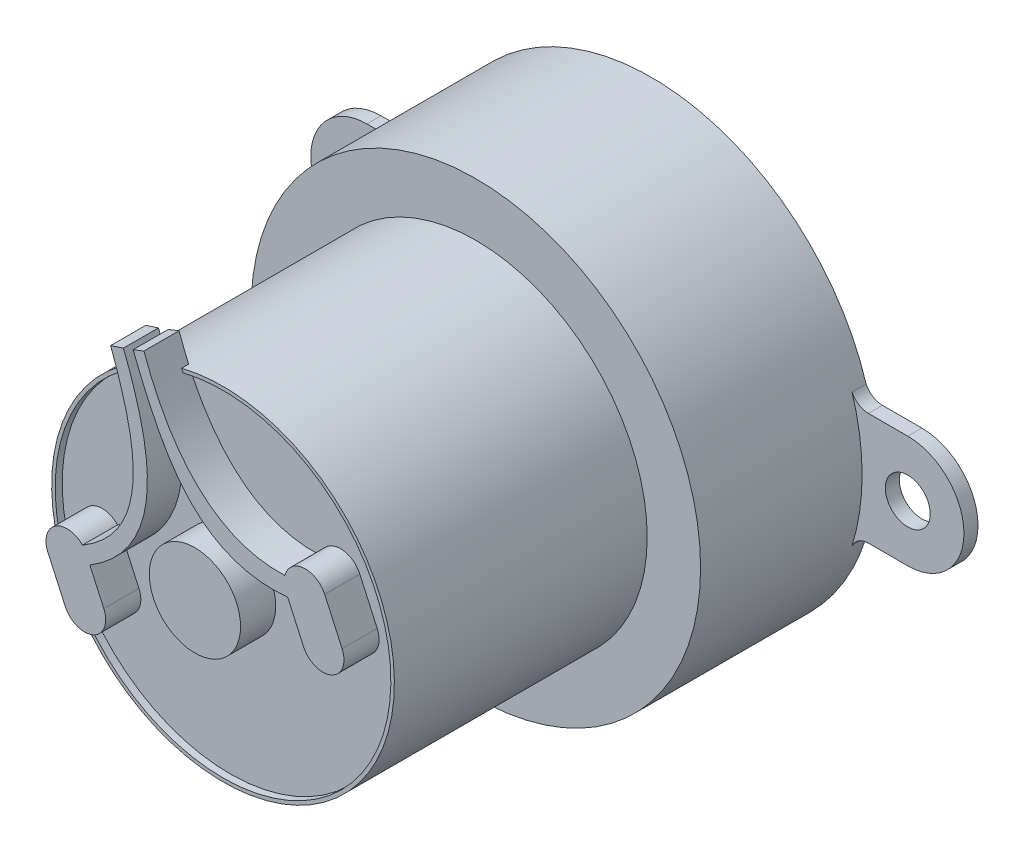
from build123d import *
from build123d.topology import SkipClean

# Parameters (mm, degrees)
CROQUIS1_R               = 1.6
SALIENTE_EXTRUIR1_DEPTH  = 1
CROQUIS2_R               = 16
SALIENTE_EXTRUIR2_DEPTH  = 11.5
CROQUIS3_R               = 12.2
SALIENTE_EXTRUIR3_DEPTH  = 18
CROQUIS4_R               = 11.95
CORTAR_EXTRUIR1_DEPTH    = 0.5
CROQUIS5_R               = 3.25
SALIENTE_EXTRUIR4_DEPTH  = 2.5
SALIENTE_EXTRUIR6_DEPTH  = 2.5
SALIENTE_EXTRUIR7_START  = 2.5
SALIENTE_EXTRUIR7_DEPTH  = 2.5
CROQUIS8_W               = 0.240154474
CROQUIS8_H               = 2.311486816
CORTAR_EXTRUIR2_DEPTH    = 0.5
CROQUIS9_R               = 4.85
SALIENTE_EXTRUIR8_DEPTH  = 2
CROQUIS11_R              = 4
SALIENTE_EXTRUIR9_DEPTH  = 0.2
CROQUIS12_R              = 2.5
SALIENTE_EXTRUIR10_DEPTH = 1.2
SALIENTE_EXTRUIR11_DEPTH = 6.7
CROQUIS14_R              = 1.6
SALIENTE_EXTRUIR12_DEPTH = 0.2
CORTAR_EXTRUIR3_DEPTH    = 0.2
CORTAR_EXTRUIR4_DEPTH    = 0.2


with BuildPart() as part:
    # Croquis1 → Saliente-Extruir1 (new body)
    with BuildSketch(Plane.XY):
        with BuildLine():
            ThreePointArc((-16.45, -4), (-15.762313684, -4.197739458), (-15.284693364, -4.730554804))
            ThreePointArc((-15.284693364, -4.730554804), (0, -16), (15.284693364, -4.730554804))
            ThreePointArc((15.284693364, -4.730554804), (15.762313684, -4.197739458), (16.45, -4))
            Line((16.45, -4), (19.25, -4))
            ThreePointArc((19.25, -4), (23.25, 0), (19.25, 4))
            Line((19.25, 4), (16.45, 4))
            ThreePointArc((16.45, 4), (15.762313684, 4.197739458), (15.284693364, 4.730554804))
            ThreePointArc((15.284693364, 4.730554804), (0, 16), (-15.284693364, 4.730554804))
            ThreePointArc((-15.284693364, 4.730554804), (-15.762313684, 4.197739458), (-16.45, 4))
            Line((-16.45, 4), (-19.25, 4))
            ThreePointArc((-19.25, 4), (-23.25, 0), (-19.25, -4))
            Line((-19.25, -4), (-16.45, -4))
        make_face()
        with Locations((-19.25, 0)):
            Circle(CROQUIS1_R, mode=Mode.SUBTRACT)
        with Locations((19.25, 0)):
            Circle(CROQUIS1_R, mode=Mode.SUBTRACT)
    extrude(amount=SALIENTE_EXTRUIR1_DEPTH)

    # Croquis2 → Saliente-Extruir2 (add)
    with BuildSketch(Plane.XY.offset(1)):
        with Locations(Location((0, 0, 0), (0, 0, 162.802901405))):
            Circle(CROQUIS2_R)
    extrude(amount=SALIENTE_EXTRUIR2_DEPTH)

    # Croquis3 → Saliente-Extruir3 (add)
    with BuildSketch(Plane.XY.offset(12.5)):
        Circle(CROQUIS3_R)
    extrude(amount=SALIENTE_EXTRUIR3_DEPTH)

    # Croquis4 → Cortar-Extruir1 (cut)
    with BuildSketch(Plane.XY.offset(30.5)):
        Circle(CROQUIS4_R)
    extrude(amount=-CORTAR_EXTRUIR1_DEPTH, mode=Mode.SUBTRACT)

    # Croquis5 → Saliente-Extruir4 (add)
    with BuildSketch(Plane.XY.offset(30)):
        Circle(CROQUIS5_R)
    extrude(amount=SALIENTE_EXTRUIR4_DEPTH)

    # Croquis6 → Saliente-Extruir6 (add)
    with BuildSketch(Plane.XY.offset(30)):
        with BuildLine():
            Line((10.476994696, 2.255916961), (9.238424672, 4.988304981))
            ThreePointArc((9.238424672, 4.988304981), (7.243885391, 5.738622321), (6.493568052, 3.744083039))
            Line((6.493568052, 3.744083039), (7.732138076, 1.011695019))
            ThreePointArc((7.732138076, 1.011695019), (9.726677357, 0.261377679), (10.476994696, 2.255916961))
        make_face()
        with BuildLine():
            Line((-6.487241223, -3.751451634), (-7.725811247, -1.019063613))
            ThreePointArc((-7.725811247, -1.019063613), (-9.720350528, -0.268746274), (-10.470667867, -2.263285555))
            Line((-10.470667867, -2.263285555), (-9.232097843, -4.995673576))
            ThreePointArc((-9.232097843, -4.995673576), (-7.237558562, -5.745990915), (-6.487241223, -3.751451634))
        make_face()
    extrude(amount=SALIENTE_EXTRUIR6_DEPTH)

    # Croquis7 → Saliente-Extruir7 (add)
    with BuildSketch(Plane.XY.offset(30).offset(SALIENTE_EXTRUIR7_START)):
        with BuildLine():
            add(Edge.make_bspline(
                [(-7.480961723, -1.559221935), (-2.422994836, 1.516253338), (-2.915195224, 6.613819829), (-4.40299632, 11.109280958)],
                knots=[0.063043533, 0.063043533, 0.063043533, 0.063043533, 0.882131138, 0.882131138, 0.882131138, 0.882131138], degree=3))
            ThreePointArc((-4.40299632, 11.109280958), (-4.86143825, 10.916451719), (-5.31145955, 10.704713796))
            add(Edge.make_bspline(
                [(-8.007667665, -0.601350332), (-3.447156238, 2.075547121), (-4.027792303, 6.63720219), (-5.31145955, 10.704713796)],
                knots=[0.063509127, 0.063509127, 0.063509127, 0.063509127, 0.864910683, 0.864910683, 0.864910683, 0.864910683], degree=3))
            ThreePointArc((-8.007667665, -0.601350332), (-7.849154454, -0.798341308), (-7.725811247, -1.019063613))
            Line((-7.725811247, -1.019063613), (-7.480961723, -1.559221935))
        make_face()
        with BuildLine():
            ThreePointArc((-5.31145955, 10.704713796), (-4.86143825, 10.916451719), (-4.40299632, 11.109280958))
            add(Edge.make_bspline(
                [(-4.40299632, 11.109280958), (-4.617094812, 11.756189643), (-4.851810172, 12.39062995), (-5.093570104, 13.004781954)],
                knots=[0.882131138, 0.882131138, 0.882131138, 0.882131138, 1, 1, 1, 1], degree=3))
            Line((-5.093570104, 13.004781954), (-5.999280384, 12.708133268))
            add(Edge.make_bspline(
                [(-5.31145955, 10.704713796), (-5.527842623, 11.390359289), (-5.764202051, 12.06196389), (-5.999280384, 12.708133268)],
                knots=[0.864910683, 0.864910683, 0.864910683, 0.864910683, 1, 1, 1, 1], degree=3))
        make_face()
        with BuildLine():
            add(Edge.make_bspline(
                [(-3.629573828, 11.385459755), (-3.899827273, 12.01114588), (-4.154881858, 12.637786156), (-4.40299632, 13.250284315)],
                knots=[0.876590147, 0.876590147, 0.876590147, 0.876590147, 1, 1, 1, 1], degree=3))
            ThreePointArc((-3.629573828, 11.385459755), (-3.236631517, 11.503335013), (-2.839874712, 11.607653149))
            add(Edge.make_bspline(
                [(-2.839874712, 11.607653149), (-3.136799167, 12.252899863), (-3.398874236, 12.908724785), (-3.629573828, 13.558248221)],
                knots=[0.856488018, 0.856488018, 0.856488018, 0.856488018, 1, 1, 1, 1], degree=3))
            Line((-3.629573828, 13.558248221), (-4.40299632, 13.250284315))
        make_face()
        with BuildLine():
            ThreePointArc((-2.839874712, 11.607653149), (-3.236631517, 11.503335013), (-3.629573828, 11.385459755))
            add(Edge.make_bspline(
                [(6.603292332, 3.502022194), (0.752871457, 2.913283209), (-1.790330385, 7.127274996), (-3.629573828, 11.385459755)],
                knots=[0.036709041, 0.036709041, 0.036709041, 0.036709041, 0.876590147, 0.876590147, 0.876590147, 0.876590147], degree=3))
            Line((6.603292332, 3.502022194), (6.493568052, 3.744083039))
            ThreePointArc((6.493568052, 3.744083039), (6.365108629, 4.232337596), (6.405138105, 4.735618806))
            add(Edge.make_bspline(
                [(6.405138105, 4.735618806), (1.729420512, 4.534171783), (-1.131825908, 7.895891242), (-2.839874712, 11.607653149)],
                knots=[0.030939747, 0.030939747, 0.030939747, 0.030939747, 0.856488018, 0.856488018, 0.856488018, 0.856488018], degree=3))
        make_face()
    extrude(amount=-SALIENTE_EXTRUIR7_DEPTH)

    # Croquis8 → Cortar-Extruir2 (cut)
    # profile 1 of 11: a face of its own
    with BuildSketch(Plane(origin=(0, 0, 0), x_dir=(-1, 0, 0), z_dir=(0, 0, -1))):
        Polygon((-4.383996124, 12.208362546), (-4.383996124, 14.519849362), (-4.14384165, 14.519849362), (-4.14384165, 13.368327419), (-3.16352358, 14.519849362), (-2.857701867, 14.519849362), (-3.656027873, 13.582214998), (-2.82299204, 12.208362546), (-3.098794444, 12.208362546), (-3.817381661, 13.392718108), (-4.14384165, 13.009502863), (-4.14384165, 12.208362546), align=None)
    # profile 2 of 11: a face of its own
    with BuildSketch(Plane(origin=(0, 0, 0), x_dir=(-1, 0, 0), z_dir=(0, 0, -1))):
        with Locations((-2.432741019, 13.364105954)):
            Rectangle(CROQUIS8_W, CROQUIS8_H)
    # profile 3 of 11: a face of its own
    with BuildSketch(Plane(origin=(0, 0, 0), x_dir=(-1, 0, 0), z_dir=(0, 0, -1))):
        Polygon((-1.862374142, 12.208362546), (-1.862374142, 14.519849362), (-1.606740962, 14.519849362), (-0.631582461, 12.677414253), (-0.631582461, 14.519849362), (-0.391427987, 14.519849362), (-0.391427987, 12.208362546), (-0.648468322, 12.208362546), (-1.622219668, 14.048452396), (-1.622219668, 12.208362546), align=None)
    # profile 4 of 11: a face of its own
    with BuildSketch(Plane(origin=(0, 0, 0), x_dir=(-1, 0, 0), z_dir=(0, 0, -1))):
        with BuildLine():
            Line((0.959440932, 13.108941825), (0.959440932, 13.379115608))
            Line((0.959440932, 13.379115608), (1.769962283, 13.379115608))
            Line((1.769962283, 13.379115608), (1.769962283, 12.532477276))
            add(Edge.make_bspline(
                [(1.769962283, 12.532477276), (1.73913888, 12.504428867), (1.678812556, 12.449533651), (1.582665706, 12.377861404), (1.485322908, 12.31625377), (1.386260563, 12.265918637), (1.285656864, 12.22638462), (1.18357552, 12.198781232), (1.079939459, 12.181655214), (1.01031942, 12.179449778), (0.97538869, 12.178343236)],
                knots=[0, 0, 0, 0, 1.121144615, 2.194259096, 3.22291754, 4.218514423, 5.180530362, 6.126881594, 7.060193117, 8, 8, 8, 8], degree=3))
            add(Edge.make_bspline(
                [(0.97538869, 12.178343236), (0.952395006, 12.17887765), (0.906798365, 12.179937397), (0.83935409, 12.185836343), (0.773737064, 12.196857133), (0.710081813, 12.211744858), (0.648194683, 12.230904456), (0.588617252, 12.255291255), (0.530237816, 12.282545969), (0.474425188, 12.315185928), (0.420971707, 12.351710518), (0.37022988, 12.392207478), (0.322099517, 12.43626375), (0.277453812, 12.485055265), (0.23547522, 12.537497482), (0.195632134, 12.593413612), (0.159744384, 12.653956918), (0.125804435, 12.717876834), (0.09596866, 12.785785787), (0.070042791, 12.857098884), (0.048135269, 12.93170356), (0.029757477, 13.009643309), (0.01571777, 13.090942793), (0.006134772, 13.175522558), (-0.000283496, 13.26331686), (-0.000875732, 13.322973957), (-0.001176966, 13.353317765)],
                knots=[0, 0, 0, 0, 0.963545397, 1.910717405, 2.833679837, 3.748938136, 4.648160849, 5.544707014, 6.44428759, 7.345417256, 8.250301349, 9.15471106, 10.063381295, 10.981308332, 11.922549023, 12.876762963, 13.855312354, 14.869185747, 15.907484256, 16.960251447, 18.046404778, 19.163470092, 20.313696906, 21.500864286, 22.728847097, 24, 24, 24, 24], degree=3))
            add(Edge.make_bspline(
                [(-0.001176966, 13.353317765), (-0.000863025, 13.384129131), (-0.000245655, 13.444720384), (0.00600854, 13.534112042), (0.016284384, 13.620353362), (0.030434661, 13.703616021), (0.047934097, 13.784113469), (0.070664748, 13.861358069), (0.096811214, 13.935652591), (0.126979815, 14.006492963), (0.159936113, 14.073815101), (0.196178297, 14.13666507), (0.234497763, 14.195231459), (0.276106379, 14.248552435), (0.319069652, 14.298309308), (0.365228898, 14.342820074), (0.413656608, 14.383084893), (0.465053931, 14.41818424), (0.518634707, 14.44932234), (0.574745104, 14.476006829), (0.632967093, 14.499106536), (0.693594963, 14.518021454), (0.75675399, 14.531846049), (0.822219302, 14.542119375), (0.890028703, 14.549064122), (0.936127332, 14.549598446), (0.959440932, 14.549868671)],
                knots=[0, 0, 0, 0, 1.283121513, 2.523287582, 3.730023389, 4.899079804, 6.039789461, 7.15880579, 8.250410031, 9.318392136, 10.363902253, 11.370311636, 12.338384822, 13.276198214, 14.185288112, 15.074093801, 15.943727649, 16.805327304, 17.663128848, 18.522362821, 19.39060582, 20.270106898, 21.164311373, 22.080741752, 23.02936765, 24, 24, 24, 24], degree=3))
            add(Edge.make_bspline(
                [(0.959440932, 14.549868671), (0.993424851, 14.549060191), (1.059534638, 14.547487434), (1.155382529, 14.532637273), (1.244782995, 14.508461343), (1.327393781, 14.473910692), (1.403229836, 14.43059646), (1.472270978, 14.379129163), (1.534327064, 14.319518933), (1.579707385, 14.262933846), (1.612598547, 14.213440943), (1.635714688, 14.172659069), (1.657253168, 14.128677415), (1.67682447, 14.081099425), (1.695086649, 14.030378229), (1.712036356, 13.976444676), (1.726958799, 13.919096814), (1.735547401, 13.879625593), (1.739942974, 13.859424557)],
                knots=[0, 0, 0, 0, 1.421442541, 2.765168547, 4.047841273, 5.288586259, 6.501956771, 7.694182091, 8.88353085, 10.093491299, 10.721426975, 11.369099503, 12.053886711, 12.769643166, 13.521004755, 14.309514717, 15.134823968, 16, 16, 16, 16], degree=3))
            Line((1.739942974, 13.859424557), (1.4997885, 13.799385939))
            add(Edge.make_bspline(
                [(1.4997885, 13.799385939), (1.49194775, 13.828911827), (1.477186235, 13.884499224), (1.449619408, 13.961089738), (1.418926135, 14.025856937), (1.384610099, 14.080145548), (1.345183264, 14.125337717), (1.301513497, 14.165333148), (1.251093785, 14.198767675), (1.196361403, 14.228186518), (1.136661476, 14.2507873), (1.073442858, 14.268010141), (1.00634382, 14.277875266), (0.960410615, 14.279079303), (0.93692645, 14.279694888)],
                knots=[0, 0, 0, 0, 1.35370667, 2.548578037, 3.602482135, 4.525244969, 5.385205021, 6.25372376, 7.141792941, 8.059466754, 9.00287123, 9.96447941, 10.959304047, 12, 12, 12, 12], degree=3))
            add(Edge.make_bspline(
                [(0.93692645, 14.279694888), (0.91971666, 14.279469333), (0.885855446, 14.279025541), (0.835860938, 14.274176324), (0.787755988, 14.26629489), (0.741435838, 14.255288557), (0.696775978, 14.242161208), (0.654411161, 14.224280199), (0.61356901, 14.204271995), (0.574425547, 14.18120862), (0.537089861, 14.154869648), (0.502003833, 14.12465024), (0.468538452, 14.091438889), (0.437522378, 14.054180812), (0.40744875, 14.014246775), (0.379886871, 13.970298776), (0.353928209, 13.923215525), (0.330225693, 13.872729174), (0.308488029, 13.819119453), (0.289785929, 13.762567473), (0.274500307, 13.702930851), (0.261092161, 13.640730169), (0.251690142, 13.575332685), (0.243849651, 13.507172091), (0.239811425, 13.436076699), (0.23925832, 13.387719), (0.238977509, 13.36316785)],
                knots=[0, 0, 0, 0, 0.95244652, 1.873991161, 2.777557121, 3.648832578, 4.508552549, 5.350797697, 6.190771618, 7.02501797, 7.86316154, 8.7165405, 9.585620601, 10.469996113, 11.397859992, 12.351132043, 13.338946381, 14.372712626, 15.436726846, 16.539770861, 17.66713286, 18.84353329, 20.060284837, 21.322933361, 22.640856277, 24, 24, 24, 24], degree=3))
            add(Edge.make_bspline(
                [(0.238977509, 13.36316785), (0.239598334, 13.326247232), (0.240802643, 13.254626616), (0.250337915, 13.150741725), (0.265419234, 13.053757039), (0.287389575, 12.963984764), (0.315517662, 12.881349761), (0.349689263, 12.805697279), (0.390528964, 12.73731604), (0.437767895, 12.676487157), (0.489981475, 12.623007763), (0.546045188, 12.57624372), (0.605820327, 12.536427299), (0.6698165, 12.504576767), (0.737094355, 12.478884655), (0.8084264, 12.461147222), (0.88346286, 12.450809543), (0.934705008, 12.449291504), (0.960848087, 12.44851702)],
                knots=[0, 0, 0, 0, 1.344305217, 2.607756079, 3.795613497, 4.915552292, 5.968887625, 6.970219091, 7.933010886, 8.862341374, 9.768284732, 10.649651063, 11.516609893, 12.377263757, 13.247581458, 14.134137142, 15.048060964, 16, 16, 16, 16], degree=3))
            add(Edge.make_bspline(
                [(0.960848087, 12.44851702), (0.986541563, 12.449327689), (1.038723857, 12.45097412), (1.117216189, 12.464722799), (1.196428302, 12.487069576), (1.274795418, 12.517202317), (1.349489842, 12.553225311), (1.41793233, 12.59284798), (1.478058319, 12.636395452), (1.512916392, 12.669080609), (1.529807809, 12.684919081)],
                knots=[0, 0, 0, 0, 0.978162575, 1.986604247, 3.025534994, 4.109442341, 5.180230685, 6.181206173, 7.118654505, 8, 8, 8, 8], degree=3))
            Line((1.529807809, 12.684919081), (1.529807809, 13.108941825))
            Line((1.529807809, 13.108941825), (0.959440932, 13.108941825))
        make_face()
    # profile 5 of 11: a face of its own
    with BuildSketch(Plane(origin=(0, 0, 0), x_dir=(-1, 0, 0), z_dir=(0, 0, -1))):
        Polygon((2.130193995, 12.208362546), (2.130193995, 14.519849362), (2.370348469, 14.519849362), (2.370348469, 12.478536329), (3.330966367, 12.478536329), (3.330966367, 12.208362546), align=None)
    # profile 6 of 11: a face of its own
    with BuildSketch(Plane(origin=(0, 0, 0), x_dir=(-1, 0, 0), z_dir=(0, 0, -1))):
        with BuildLine():
            Line((4.141487718, 12.208362546), (4.141487718, 13.187742512))
            Line((4.141487718, 13.187742512), (3.421024295, 14.519849362))
            Line((3.421024295, 14.519849362), (3.690259975, 14.519849362))
            Line((3.690259975, 14.519849362), (4.077227634, 13.822369472))
            add(Edge.make_bspline(
                [(4.077227634, 13.822369472), (4.095964896, 13.788512402), (4.132752596, 13.722039308), (4.184767789, 13.622785921), (4.233703595, 13.526451146), (4.264047049, 13.462517415), (4.278919869, 13.431180348)],
                knots=[0, 0, 0, 0, 1.054805564, 2.070946718, 3.054476075, 4, 4, 4, 4], degree=3))
            add(Edge.make_bspline(
                [(4.278919869, 13.431180348), (4.293021268, 13.462508912), (4.322135237, 13.527190354), (4.369832228, 13.626418888), (4.422362816, 13.731186655), (4.459279655, 13.802860737), (4.478266845, 13.839724386)],
                knots=[0, 0, 0, 0, 0.906747811, 1.872085736, 2.905564156, 4, 4, 4, 4], degree=3))
            Line((4.478266845, 13.839724386), (4.833338987, 14.519849362))
            Line((4.833338987, 14.519849362), (5.102105616, 14.519849362))
            Line((5.102105616, 14.519849362), (4.381642193, 13.187742512))
            Line((4.381642193, 13.187742512), (4.381642193, 12.208362546))
            Line((4.381642193, 12.208362546), (4.141487718, 12.208362546))
        make_face()
    # profile 7 of 11: a face of its own
    with BuildSketch(Plane(origin=(0, 0, 0), x_dir=(-1, 0, 0), z_dir=(0, 0, -1))):
        with BuildLine():
            Line((-4.383996124, 7.395910264), (-4.383996124, 9.70739708))
            Line((-4.383996124, 9.70739708), (-4.008285706, 9.70739708))
            Line((-4.008285706, 9.70739708), (-3.558465118, 8.070875672))
            Line((-3.558465118, 8.070875672), (-3.46840719, 7.728467925))
            add(Edge.make_bspline(
                [(-3.46840719, 7.728467925), (-3.465469493, 7.73973405), (-3.459296588, 7.763407267), (-3.4488227, 7.800734773), (-3.437004616, 7.841585091), (-3.425086238, 7.886309433), (-3.411325484, 7.93426675), (-3.396241219, 7.985795249), (-3.380319242, 8.041151177), (-3.369430031, 8.079316546), (-3.363808659, 8.099018774)],
                knots=[0, 0, 0, 0, 0.72569615, 1.52488642, 2.416426408, 3.376296137, 4.409732583, 5.526177123, 6.722930645, 8, 8, 8, 8], degree=3))
            Line((-3.363808659, 8.099018774), (-2.892880745, 9.70739708))
            Line((-2.892880745, 9.70739708), (-2.552818256, 9.70739708))
            Line((-2.552818256, 9.70739708), (-2.552818256, 7.395910264))
            Line((-2.552818256, 7.395910264), (-2.792972731, 7.395910264))
            Line((-2.792972731, 7.395910264), (-2.792972731, 9.304012612))
            Line((-2.792972731, 9.304012612), (-3.347860901, 7.395910264))
            Line((-3.347860901, 7.395910264), (-3.593643996, 7.395910264))
            Line((-3.593643996, 7.395910264), (-4.14384165, 9.41330166))
            Line((-4.14384165, 9.41330166), (-4.14384165, 7.395910264))
            Line((-4.14384165, 7.395910264), (-4.383996124, 7.395910264))
        make_face()
    # profile 8 of 11: a face of its own
    with BuildSketch(Plane(origin=(0, 0, 0), x_dir=(-1, 0, 0), z_dir=(0, 0, -1))):
        with BuildLine():
            add(Edge.make_bspline(
                [(-2.222605854, 8.521165311), (-2.221789399, 8.56856453), (-2.22019946, 8.660868297), (-2.20807987, 8.795069633), (-2.187492352, 8.920784759), (-2.159217002, 9.038134356), (-2.122066164, 9.146907415), (-2.077144311, 9.247526231), (-2.023481491, 9.339522223), (-1.961862219, 9.422492055), (-1.89464616, 9.496587669), (-1.822291274, 9.560808461), (-1.746321072, 9.615727802), (-1.665793838, 9.659897896), (-1.581746397, 9.695428293), (-1.493003661, 9.719209221), (-1.400617019, 9.735106844), (-1.337573581, 9.736639376), (-1.305609765, 9.73741639)],
                knots=[0, 0, 0, 0, 1.331070849, 2.592086014, 3.780305682, 4.906005075, 5.978011684, 7.003908552, 7.995748348, 8.962674125, 9.901370513, 10.800246893, 11.675154716, 12.528146756, 13.374603752, 14.231114787, 15.103152967, 16, 16, 16, 16], degree=3))
            add(Edge.make_bspline(
                [(-1.305609765, 9.73741639), (-1.284639641, 9.736952055), (-1.243221965, 9.736034957), (-1.181800582, 9.729128766), (-1.121804138, 9.718690237), (-1.063285058, 9.702809113), (-1.005923206, 9.683299827), (-0.950145579, 9.658827914), (-0.895914058, 9.629864241), (-0.843007764, 9.597329704), (-0.79223789, 9.560102557), (-0.744000212, 9.518819926), (-0.698225354, 9.473651168), (-0.655643178, 9.424239259), (-0.615544159, 9.371053807), (-0.578596535, 9.313727736), (-0.5442951, 9.252404193), (-0.512486756, 9.187494385), (-0.483857931, 9.118940961), (-0.458836402, 9.04710999), (-0.4385592, 8.9717457), (-0.420902039, 8.893586813), (-0.408122976, 8.811903336), (-0.398066193, 8.7272894), (-0.392501264, 8.639285295), (-0.391789884, 8.579647637), (-0.391427987, 8.549308414)],
                knots=[0, 0, 0, 0, 0.899824171, 1.777224896, 2.649917024, 3.510973429, 4.376801712, 5.248254587, 6.121797682, 7.013780974, 7.911701495, 8.820786024, 9.736582303, 10.668970754, 11.617827344, 12.593151753, 13.593637019, 14.632021419, 15.69381936, 16.780371356, 17.893899404, 19.04171746, 20.217729733, 21.440466177, 22.69789874, 24, 24, 24, 24], degree=3))
            add(Edge.make_bspline(
                [(-0.391427987, 8.549308414), (-0.392182708, 8.507856331), (-0.393660617, 8.426684139), (-0.404212592, 8.307794019), (-0.423401756, 8.194944117), (-0.448073541, 8.087557299), (-0.481671943, 7.986474142), (-0.522122138, 7.891183738), (-0.569575168, 7.801412995), (-0.607873381, 7.746403922), (-0.626891944, 7.719086891)],
                knots=[0, 0, 0, 0, 1.133525988, 2.219690354, 3.25996653, 4.261750254, 5.229810789, 6.168477289, 7.090481605, 8, 8, 8, 8], degree=3))
            add(Edge.make_bspline(
                [(-0.626891944, 7.719086891), (-0.648831603, 7.691076128), (-0.691715275, 7.636325764), (-0.764654873, 7.563936076), (-0.842639931, 7.502805989), (-0.925531598, 7.452128068), (-1.013904189, 7.413745147), (-1.107054912, 7.385793739), (-1.205415665, 7.369092831), (-1.272711659, 7.366972055), (-1.30701692, 7.365890955)],
                knots=[0, 0, 0, 0, 1.070119256, 2.09167529, 3.083880958, 4.046692552, 5.007570185, 5.975302747, 6.967876608, 8, 8, 8, 8], degree=3))
            add(Edge.make_bspline(
                [(-1.30701692, 7.365890955), (-1.341483267, 7.366934306), (-1.409125515, 7.368981945), (-1.5081427, 7.386271131), (-1.601803244, 7.414992915), (-1.690612568, 7.454603583), (-1.773667911, 7.506344212), (-1.851420018, 7.569361438), (-1.924363484, 7.643345023), (-1.96681618, 7.69964579), (-1.988549052, 7.728467925)],
                knots=[0, 0, 0, 0, 1.027712946, 2.016947528, 2.987811303, 3.944031492, 4.90967079, 5.89821231, 6.924028725, 8, 8, 8, 8], degree=3))
            add(Edge.make_bspline(
                [(-1.988549052, 7.728467925), (-2.007349239, 7.756299031), (-2.044838332, 7.811796506), (-2.092130681, 7.900877538), (-2.132695749, 7.9937942), (-2.165293987, 8.091213148), (-2.191415984, 8.19256794), (-2.209460501, 8.298306242), (-2.220420305, 8.408360346), (-2.221869255, 8.483146456), (-2.222605854, 8.521165311)],
                knots=[0, 0, 0, 0, 0.958933014, 1.912189966, 2.876424288, 3.85247362, 4.843745406, 5.863745303, 6.913996742, 8, 8, 8, 8], degree=3))
        make_face()
        with BuildLine():
            add(Edge.make_bspline(
                [(-1.98245138, 8.517412898), (-1.981769521, 8.483466818), (-1.980444213, 8.417486843), (-1.971672133, 8.321345349), (-1.956249223, 8.231012355), (-1.934668878, 8.146496515), (-1.907786528, 8.067550287), (-1.87369693, 7.994901537), (-1.833752537, 7.927859856), (-1.787836034, 7.866957151), (-1.737332673, 7.812970072), (-1.6842364, 7.765403721), (-1.62788234, 7.726011354), (-1.569610002, 7.69261326), (-1.508140834, 7.667096628), (-1.443983053, 7.649448513), (-1.377297651, 7.638218166), (-1.331921658, 7.636789694), (-1.308893127, 7.636064738)],
                knots=[0, 0, 0, 0, 1.312267352, 2.550614609, 3.728111592, 4.851026838, 5.919546711, 6.947055793, 7.94734328, 8.931337301, 9.889295514, 10.801324679, 11.681722049, 12.542374657, 13.393208477, 14.246700222, 15.110192087, 16, 16, 16, 16], degree=3))
            add(Edge.make_bspline(
                [(-1.308893127, 7.636064738), (-1.285400397, 7.636812427), (-1.238946741, 7.638290878), (-1.170763369, 7.649233891), (-1.105510421, 7.667464748), (-1.043545927, 7.69379896), (-0.984267456, 7.726583375), (-0.927963954, 7.766916232), (-0.874836277, 7.814718208), (-0.824636432, 7.869399254), (-0.779182294, 7.931503566), (-0.738953807, 8.000304083), (-0.705755535, 8.076460192), (-0.678871561, 8.159346507), (-0.656994158, 8.248805018), (-0.642656126, 8.345373224), (-0.632791846, 8.448569948), (-0.631993294, 8.51973283), (-0.631582461, 8.556344189)],
                knots=[0, 0, 0, 0, 0.878770405, 1.737648083, 2.57658969, 3.407764765, 4.250999223, 5.106523145, 5.993164277, 6.920704469, 7.879005581, 8.867335561, 9.896730148, 10.980825599, 12.124467321, 13.338272289, 14.63061378, 16, 16, 16, 16], degree=3))
            add(Edge.make_bspline(
                [(-0.631582461, 8.556344189), (-0.631811674, 8.580429487), (-0.632263115, 8.627866086), (-0.63707662, 8.698160418), (-0.645146153, 8.766360736), (-0.655547247, 8.832879979), (-0.67061856, 8.897004909), (-0.687024145, 8.959733392), (-0.707834345, 9.020221988), (-0.723950881, 9.059399608), (-0.731959526, 9.078867792)],
                knots=[0, 0, 0, 0, 1.078644903, 2.124418214, 3.153743212, 4.154196665, 5.137842886, 6.102739285, 7.057211248, 8, 8, 8, 8], degree=3))
            add(Edge.make_bspline(
                [(-0.731959526, 9.078867792), (-0.745492353, 9.107341338), (-0.772235258, 9.163609353), (-0.826911154, 9.238904877), (-0.890203031, 9.306181495), (-0.963275724, 9.362605876), (-1.042116613, 9.409400884), (-1.126032075, 9.443099826), (-1.213792917, 9.463522783), (-1.273607177, 9.46599662), (-1.303733558, 9.467242606)],
                knots=[0, 0, 0, 0, 1.032714874, 2.040800129, 3.038924044, 4.055125724, 5.060150422, 6.038733642, 7.012177711, 8, 8, 8, 8], degree=3))
            add(Edge.make_bspline(
                [(-1.303733558, 9.467242606), (-1.327849511, 9.466495489), (-1.375388445, 9.465022723), (-1.445000918, 9.454166796), (-1.511215533, 9.435735785), (-1.574085333, 9.410104969), (-1.634029421, 9.377842519), (-1.690239457, 9.337266398), (-1.743294001, 9.289851676), (-1.792686989, 9.235030035), (-1.838259453, 9.173234235), (-1.87633828, 9.10227913), (-1.909941099, 9.024463338), (-1.936276404, 8.938151993), (-1.957584209, 8.844292816), (-1.971242665, 8.742237601), (-1.981326226, 8.632531151), (-1.982067556, 8.55668318), (-1.98245138, 8.517412898)],
                knots=[0, 0, 0, 0, 0.879508816, 1.733744975, 2.562624688, 3.381316754, 4.205651284, 5.039714663, 5.904114686, 6.796492674, 7.727389142, 8.697387403, 9.727116746, 10.814853576, 11.984051762, 13.234256004, 14.568036196, 16, 16, 16, 16], degree=3))
        make_face(mode=Mode.SUBTRACT)
    # profile 9 of 11: a face of its own
    with BuildSketch(Plane(origin=(0, 0, 0), x_dir=(-1, 0, 0), z_dir=(0, 0, -1))):
        Polygon((0.389074055, 7.395910264), (0.389074055, 9.437223297), (-0.24133144, 9.437223297), (-0.24133144, 9.70739708), (1.259634025, 9.70739708), (1.259634025, 9.437223297), (0.62922853, 9.437223297), (0.62922853, 7.395910264), align=None)
    # profile 10 of 11: a face of its own
    with BuildSketch(Plane(origin=(0, 0, 0), x_dir=(-1, 0, 0), z_dir=(0, 0, -1))):
        with BuildLine():
            add(Edge.make_bspline(
                [(1.46976919, 8.521165311), (1.470585645, 8.56856453), (1.472175584, 8.660868297), (1.484295175, 8.795069633), (1.504882693, 8.920784759), (1.533158042, 9.038134356), (1.570308881, 9.146907415), (1.615230733, 9.247526231), (1.668893554, 9.339522223), (1.730512825, 9.422492055), (1.797728885, 9.496587669), (1.87008377, 9.560808461), (1.946053973, 9.615727802), (2.026581207, 9.659897896), (2.110628648, 9.695428293), (2.199371384, 9.719209221), (2.291758026, 9.735106844), (2.354801464, 9.736639376), (2.386765279, 9.73741639)],
                knots=[0, 0, 0, 0, 1.331070849, 2.592086014, 3.780305682, 4.906005075, 5.978011684, 7.003908552, 7.995748348, 8.962674125, 9.901370513, 10.800246893, 11.675154716, 12.528146756, 13.374603752, 14.231114787, 15.103152967, 16, 16, 16, 16], degree=3))
            add(Edge.make_bspline(
                [(2.386765279, 9.73741639), (2.407735403, 9.736952055), (2.449153079, 9.736034957), (2.510574463, 9.729128766), (2.570570907, 9.718690237), (2.629089986, 9.702809113), (2.686451838, 9.683299827), (2.742229465, 9.658827914), (2.796460987, 9.629864241), (2.849367281, 9.597329704), (2.900137155, 9.560102557), (2.948374832, 9.518819926), (2.99414969, 9.473651168), (3.036731867, 9.424239259), (3.076830886, 9.371053807), (3.113778509, 9.313727736), (3.148079944, 9.252404193), (3.179888289, 9.187494385), (3.208517114, 9.118940961), (3.233538643, 9.04710999), (3.253815845, 8.9717457), (3.271473005, 8.893586813), (3.284252069, 8.811903336), (3.294308852, 8.7272894), (3.29987378, 8.639285295), (3.30058516, 8.579647637), (3.300947058, 8.549308414)],
                knots=[0, 0, 0, 0, 0.899824171, 1.777224896, 2.649917024, 3.510973429, 4.376801712, 5.248254587, 6.121797682, 7.013780974, 7.911701495, 8.820786024, 9.736582303, 10.668970754, 11.617827344, 12.593151753, 13.593637019, 14.632021419, 15.69381936, 16.780371356, 17.893899404, 19.04171746, 20.217729733, 21.440466177, 22.69789874, 24, 24, 24, 24], degree=3))
            add(Edge.make_bspline(
                [(3.300947058, 8.549308414), (3.300192336, 8.507856331), (3.298714428, 8.426684139), (3.288162452, 8.307794019), (3.268973289, 8.194944117), (3.244301503, 8.087557299), (3.210703101, 7.986474142), (3.170252907, 7.891183738), (3.122799876, 7.801412995), (3.084501663, 7.746403922), (3.065483101, 7.719086891)],
                knots=[0, 0, 0, 0, 1.133525988, 2.219690354, 3.25996653, 4.261750254, 5.229810789, 6.168477289, 7.090481605, 8, 8, 8, 8], degree=3))
            add(Edge.make_bspline(
                [(3.065483101, 7.719086891), (3.043543441, 7.691076128), (3.00065977, 7.636325764), (2.927720171, 7.563936076), (2.849735113, 7.502805989), (2.766843446, 7.452128068), (2.678470855, 7.413745147), (2.585320132, 7.385793739), (2.486959379, 7.369092831), (2.419663386, 7.366972055), (2.385358124, 7.365890955)],
                knots=[0, 0, 0, 0, 1.070119256, 2.09167529, 3.083880958, 4.046692552, 5.007570185, 5.975302747, 6.967876608, 8, 8, 8, 8], degree=3))
            add(Edge.make_bspline(
                [(2.385358124, 7.365890955), (2.350891777, 7.366934306), (2.28324953, 7.368981945), (2.184232345, 7.386271131), (2.090571801, 7.414992915), (2.001762477, 7.454603583), (1.918707133, 7.506344212), (1.840955027, 7.569361438), (1.76801156, 7.643345023), (1.725558864, 7.69964579), (1.703825993, 7.728467925)],
                knots=[0, 0, 0, 0, 1.027712946, 2.016947528, 2.987811303, 3.944031492, 4.90967079, 5.89821231, 6.924028725, 8, 8, 8, 8], degree=3))
            add(Edge.make_bspline(
                [(1.703825993, 7.728467925), (1.685025805, 7.756299031), (1.647536712, 7.811796506), (1.600244363, 7.900877538), (1.559679296, 7.9937942), (1.527081058, 8.091213148), (1.50095906, 8.19256794), (1.482914543, 8.298306242), (1.471954739, 8.408360346), (1.47050579, 8.483146456), (1.46976919, 8.521165311)],
                knots=[0, 0, 0, 0, 0.958933014, 1.912189966, 2.876424288, 3.85247362, 4.843745406, 5.863745303, 6.913996742, 8, 8, 8, 8], degree=3))
        make_face()
        with BuildLine():
            add(Edge.make_bspline(
                [(1.709923665, 8.517412898), (1.710605523, 8.483466818), (1.711930831, 8.417486843), (1.720702912, 8.321345349), (1.736125822, 8.231012355), (1.757706167, 8.146496515), (1.784588516, 8.067550287), (1.818678114, 7.994901537), (1.858622508, 7.927859856), (1.904539011, 7.866957151), (1.955042371, 7.812970072), (2.008138644, 7.765403721), (2.064492704, 7.726011354), (2.122765042, 7.69261326), (2.18423421, 7.667096628), (2.248391991, 7.649448513), (2.315077393, 7.638218166), (2.360453387, 7.636789694), (2.383481917, 7.636064738)],
                knots=[0, 0, 0, 0, 1.312267352, 2.550614609, 3.728111592, 4.851026838, 5.919546711, 6.947055793, 7.94734328, 8.931337301, 9.889295514, 10.801324679, 11.681722049, 12.542374657, 13.393208477, 14.246700222, 15.110192087, 16, 16, 16, 16], degree=3))
            add(Edge.make_bspline(
                [(2.383481917, 7.636064738), (2.406974648, 7.636812427), (2.453428303, 7.638290878), (2.521611675, 7.649233891), (2.586864624, 7.667464748), (2.648829117, 7.69379896), (2.708107589, 7.726583375), (2.764411091, 7.766916232), (2.817538767, 7.814718208), (2.867738613, 7.869399254), (2.91319275, 7.931503566), (2.953421238, 8.000304083), (2.986619509, 8.076460192), (3.013503483, 8.159346507), (3.035380886, 8.248805018), (3.049718918, 8.345373224), (3.059583199, 8.448569948), (3.06038175, 8.51973283), (3.060792583, 8.556344189)],
                knots=[0, 0, 0, 0, 0.878770405, 1.737648083, 2.57658969, 3.407764765, 4.250999223, 5.106523145, 5.993164277, 6.920704469, 7.879005581, 8.867335561, 9.896730148, 10.980825599, 12.124467321, 13.338272289, 14.63061378, 16, 16, 16, 16], degree=3))
            add(Edge.make_bspline(
                [(3.060792583, 8.556344189), (3.06056337, 8.580429487), (3.060111929, 8.627866086), (3.055298425, 8.698160418), (3.047228892, 8.766360736), (3.036827797, 8.832879979), (3.021756485, 8.897004909), (3.005350899, 8.959733392), (2.984540699, 9.020221988), (2.968424164, 9.059399608), (2.960415518, 9.078867792)],
                knots=[0, 0, 0, 0, 1.078644903, 2.124418214, 3.153743212, 4.154196665, 5.137842886, 6.102739285, 7.057211248, 8, 8, 8, 8], degree=3))
            add(Edge.make_bspline(
                [(2.960415518, 9.078867792), (2.946882691, 9.107341338), (2.920139787, 9.163609353), (2.86546389, 9.238904877), (2.802172013, 9.306181495), (2.729099321, 9.362605876), (2.650258432, 9.409400884), (2.566342969, 9.443099826), (2.478582127, 9.463522783), (2.418767868, 9.46599662), (2.388641486, 9.467242606)],
                knots=[0, 0, 0, 0, 1.032714874, 2.040800129, 3.038924044, 4.055125724, 5.060150422, 6.038733642, 7.012177711, 8, 8, 8, 8], degree=3))
            add(Edge.make_bspline(
                [(2.388641486, 9.467242606), (2.364525534, 9.466495489), (2.3169866, 9.465022723), (2.247374126, 9.454166796), (2.181159512, 9.435735785), (2.118289711, 9.410104969), (2.058345623, 9.377842519), (2.002135588, 9.337266398), (1.949081043, 9.289851676), (1.899688055, 9.235030035), (1.854115591, 9.173234235), (1.816036765, 9.10227913), (1.782433945, 9.024463338), (1.75609864, 8.938151993), (1.734790836, 8.844292816), (1.72113238, 8.742237601), (1.711048819, 8.632531151), (1.710307488, 8.55668318), (1.709923665, 8.517412898)],
                knots=[0, 0, 0, 0, 0.879508816, 1.733744975, 2.562624688, 3.381316754, 4.205651284, 5.039714663, 5.904114686, 6.796492674, 7.727389142, 8.697387403, 9.727116746, 10.814853576, 11.984051762, 13.234256004, 14.568036196, 16, 16, 16, 16], degree=3))
        make_face(mode=Mode.SUBTRACT)
    # profile 11 of 11: a face of its own
    with BuildSketch(Plane(origin=(0, 0, 0), x_dir=(-1, 0, 0), z_dir=(0, 0, -1))):
        with BuildLine():
            Line((3.601140151, 7.395910264), (3.601140151, 9.70739708))
            Line((3.601140151, 9.70739708), (4.450123742, 9.70739708))
            add(Edge.make_bspline(
                [(4.450123742, 9.70739708), (4.471548796, 9.707273755), (4.513019195, 9.707035047), (4.573095074, 9.703601089), (4.62895625, 9.698517746), (4.680528302, 9.691758882), (4.727510166, 9.682388423), (4.770088158, 9.671021384), (4.808608668, 9.658333392), (4.85383029, 9.637404433), (4.905422431, 9.604941544), (4.961064517, 9.555482692), (5.009802449, 9.494234287), (5.05317198, 9.42386229), (5.088788379, 9.344851196), (5.114017067, 9.2586848), (5.129247129, 9.16649522), (5.131148976, 9.103005291), (5.132124925, 9.070424861)],
                knots=[0, 0, 0, 0, 0.957775898, 1.853873864, 2.6892683, 3.465319774, 4.178195347, 4.829309051, 5.435011313, 5.988660553, 7.053440284, 8.147710094, 9.30058322, 10.540256924, 11.835580405, 13.162637032, 14.543981594, 16, 16, 16, 16], degree=3))
            add(Edge.make_bspline(
                [(5.132124925, 9.070424861), (5.131614646, 9.048834645), (5.130617912, 9.006662203), (5.12457996, 8.944851179), (5.114087395, 8.886220175), (5.098040816, 8.830920903), (5.07943072, 8.778266177), (5.054993267, 8.729179002), (5.026955948, 8.683025421), (4.994368625, 8.640172276), (4.957918508, 8.600715127), (4.917010847, 8.565274191), (4.872441054, 8.533346221), (4.823861606, 8.505211562), (4.771573156, 8.480510083), (4.714957207, 8.460799351), (4.654896128, 8.443538147), (4.613118515, 8.435620823), (4.591777358, 8.431576435)],
                knots=[0, 0, 0, 0, 1.121977975, 2.191573688, 3.224240956, 4.211948119, 5.180998842, 6.122125515, 7.055751929, 7.983633331, 8.914994346, 9.842128418, 10.791356962, 11.759862547, 12.75578979, 13.791489111, 14.871831714, 16, 16, 16, 16], degree=3))
            add(Edge.make_bspline(
                [(4.591777358, 8.431576435), (4.607529302, 8.422861266), (4.63751489, 8.406270967), (4.678551262, 8.379504108), (4.713621552, 8.352561944), (4.733447111, 8.332955797), (4.742812008, 8.323694542)],
                knots=[0, 0, 0, 0, 1.158843086, 2.205987482, 3.152571606, 4, 4, 4, 4], degree=3))
            add(Edge.make_bspline(
                [(4.742812008, 8.323694542), (4.761543088, 8.301085377), (4.799215877, 8.255612807), (4.850859278, 8.183067023), (4.900326852, 8.107599115), (4.929376541, 8.054511333), (4.944035191, 8.027722915)],
                knots=[0, 0, 0, 0, 0.982253192, 1.975551771, 2.978451105, 4, 4, 4, 4], degree=3))
            Line((4.944035191, 8.027722915), (5.282221472, 7.395910264))
            Line((5.282221472, 7.395910264), (5.009233378, 7.395910264))
            Line((5.009233378, 7.395910264), (4.742342956, 7.890290764))
            add(Edge.make_bspline(
                [(4.742342956, 7.890290764), (4.72990999, 7.913471615), (4.706128694, 7.957811049), (4.670834784, 8.020766507), (4.638026623, 8.077543003), (4.607759618, 8.128195911), (4.579585223, 8.172187856), (4.554280513, 8.21012335), (4.531106102, 8.241570385), (4.503370001, 8.273970328), (4.471131289, 8.307556183), (4.4328073, 8.341286909), (4.394527822, 8.367435653), (4.355554068, 8.387348767), (4.312652334, 8.400466938), (4.264310524, 8.410286057), (4.208366277, 8.415626915), (4.168703087, 8.416240234), (4.147585391, 8.41656678)],
                knots=[0, 0, 0, 0, 1.483643366, 2.83785556, 4.070616892, 5.1822306, 6.165666296, 7.016844219, 7.754091418, 8.367230408, 9.421242841, 10.377779407, 11.241203819, 12.029974219, 12.835959019, 13.762973995, 14.808950166, 16, 16, 16, 16], degree=3))
            Line((4.147585391, 8.41656678), (3.841294625, 8.41656678))
            Line((3.841294625, 8.41656678), (3.841294625, 7.395910264))
            Line((3.841294625, 7.395910264), (3.601140151, 7.395910264))
        make_face()
        with BuildLine():
            Line((3.841294625, 8.686740564), (4.404625726, 8.686740564))
            add(Edge.make_bspline(
                [(4.404625726, 8.686740564), (4.43356563, 8.687304316), (4.487801832, 8.688360842), (4.563678264, 8.695377705), (4.628440971, 8.708075583), (4.683299661, 8.726569462), (4.730078383, 8.751074478), (4.770805389, 8.781420101), (4.806528335, 8.817661513), (4.836914516, 8.859581334), (4.862038671, 8.906264109), (4.878995447, 8.957581904), (4.890505026, 9.012063535), (4.891474022, 9.049723862), (4.891970451, 9.069017706)],
                knots=[0, 0, 0, 0, 1.47306528, 2.760668081, 3.873497699, 4.82484281, 5.696997418, 6.550136397, 7.399890849, 8.276969651, 9.17766846, 10.086208714, 11.019541422, 12, 12, 12, 12], degree=3))
            add(Edge.make_bspline(
                [(4.891970451, 9.069017706), (4.891536882, 9.082942005), (4.890691629, 9.110087793), (4.886244391, 9.149745195), (4.877564696, 9.187063889), (4.866112375, 9.222244416), (4.850715394, 9.254965363), (4.832735361, 9.285743233), (4.810091586, 9.313312632), (4.785449878, 9.339412619), (4.75693258, 9.362583449), (4.72508632, 9.382660452), (4.689917517, 9.399525499), (4.651763821, 9.413986579), (4.609850852, 9.423605588), (4.565160889, 9.431936676), (4.517138393, 9.436555527), (4.484060732, 9.436996157), (4.467009604, 9.437223297)],
                knots=[0, 0, 0, 0, 1.045235731, 2.037714497, 2.988326782, 3.915852726, 4.808207886, 5.697550021, 6.58254782, 7.478674216, 8.387536059, 9.331464042, 10.296946822, 11.310355404, 12.385965615, 13.518246496, 14.720686494, 16, 16, 16, 16], degree=3))
            Line((4.467009604, 9.437223297), (3.841294625, 9.437223297))
            Line((3.841294625, 9.437223297), (3.841294625, 8.686740564))
        make_face(mode=Mode.SUBTRACT)
    extrude(amount=-CORTAR_EXTRUIR2_DEPTH, mode=Mode.SUBTRACT)

    # Croquis9 → Saliente-Extruir8 (add)
    with BuildSketch(Plane(origin=(0, 0, 0), x_dir=(-1, 0, 0), z_dir=(0, 0, -1))):
        with Locations(Location((0, -8, 0), (0, 0, 180))):
            Circle(CROQUIS9_R)
    extrude(amount=SALIENTE_EXTRUIR8_DEPTH)

    # Croquis11 → Saliente-Extruir9 (add)
    with BuildSketch(Plane(origin=(0, 0, -2), x_dir=(-1, 0, 0), z_dir=(0, 0, -1))):
        with Locations((0, -8)):
            Circle(CROQUIS11_R)
    extrude(amount=SALIENTE_EXTRUIR9_DEPTH)

    # Croquis12 → Saliente-Extruir10 (add)
    with BuildSketch(Plane(origin=(0, 0, -2.2), x_dir=(-1, 0, 0), z_dir=(0, 0, -1))):
        with Locations((0, -8)):
            Circle(CROQUIS12_R)
    extrude(amount=SALIENTE_EXTRUIR10_DEPTH)

    # Croquis13 → Saliente-Extruir11 (add)
    with SkipClean():  # the faces are left unmerged after this step: merging them gives an invalid solid
        with BuildSketch(Plane(origin=(0, 0, -3.4), x_dir=(-1, 0, 0), z_dir=(0, 0, -1))):
            with BuildLine():
                Line((0, -9.5), (-2, -9.5))
                ThreePointArc((-2, -9.5), (-2.5, -8), (-2, -6.5))
                Line((-2, -6.5), (0, -6.5))
                Line((0, -6.5), (2, -6.5))
                ThreePointArc((2, -6.5), (2.5, -8), (2, -9.5))
                Line((2, -9.5), (0, -9.5))
            make_face()
        extrude(amount=SALIENTE_EXTRUIR11_DEPTH)

    # Croquis14 → Saliente-Extruir12 (add)
    with SkipClean():  # the faces are left unmerged after this step: merging them gives an invalid solid
        with BuildSketch(Plane(origin=(0, 0, 0), x_dir=(-1, 0, 0), z_dir=(0, 0, -1))):
            with Locations(Location((9, -9, 0), (0, 0, 180))):
                Circle(CROQUIS14_R)
            with Locations(Location((-9, 9, 0), (0, 0, 180))):
                Circle(CROQUIS14_R)
        extrude(amount=SALIENTE_EXTRUIR12_DEPTH)

    # Croquis15 → Cortar-Extruir3 (cut)
    with SkipClean():  # the faces are left unmerged after this step: merging them gives an invalid solid
        with BuildSketch(Plane(origin=(0, 0, -0.2), x_dir=(-1, 0, 0), z_dir=(0, 0, -1))):
            Polygon((8.845853233, -8.098942507), (9.115084002, -8.098942507), (9.054787528, -8.806374398), (9.631109643, -8.387103565), (9.788160925, -8.653529847), (9.129106438, -8.951506609), (9.788160925, -9.243874398), (9.631109643, -9.511702924), (9.054787528, -9.098742186), (9.115084002, -9.804070712), (8.845853233, -9.804070712), (8.910356438, -9.098742186), (8.330528714, -9.511702924), (8.17277631, -9.243874398), (8.845853233, -8.951506609), (8.17277631, -8.653529847), (8.330528714, -8.387103565), (8.910356438, -8.803569911), align=None)
        extrude(amount=-CORTAR_EXTRUIR3_DEPTH, mode=Mode.SUBTRACT)

    # Croquis16 → Cortar-Extruir4 (cut)
    with SkipClean():  # the faces are left unmerged after this step: merging them gives an invalid solid
        with BuildSketch(Plane(origin=(0, 0, -0.2), x_dir=(-1, 0, 0), z_dir=(0, 0, -1))):
            Polygon((-9.141950264, 9.86830143), (-8.872719495, 9.86830143), (-8.933015969, 9.160869539), (-8.356693854, 9.580140373), (-8.199642572, 9.313714091), (-8.858697059, 9.015737328), (-8.199642572, 8.723369539), (-8.356693854, 8.455541014), (-8.933015969, 8.868501751), (-8.872719495, 8.163173225), (-9.141950264, 8.163173225), (-9.077447059, 8.868501751), (-9.657274783, 8.455541014), (-9.815027187, 8.723369539), (-9.141950264, 9.015737328), (-9.815027187, 9.313714091), (-9.657274783, 9.580140373), (-9.077447059, 9.163674027), align=None)
        extrude(amount=-CORTAR_EXTRUIR4_DEPTH, mode=Mode.SUBTRACT)


solid = part.part
